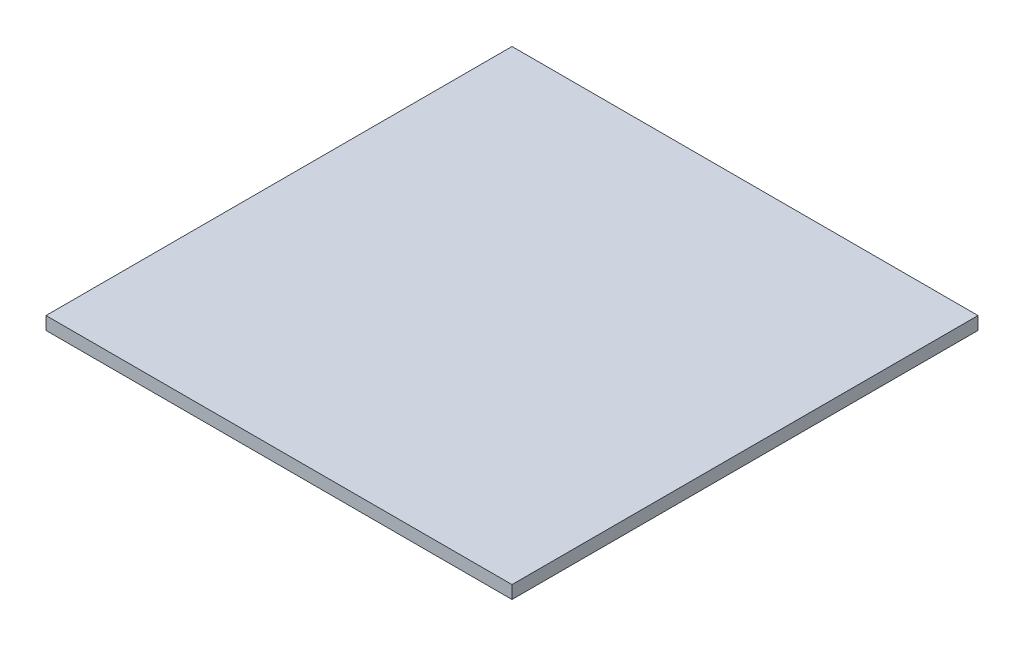
from build123d import *

# Parameters (mm, degrees)
SKETCH2_W           = 1828.8
SKETCH2_H           = 1828.8
BOSS_EXTRUDE1_DEPTH = 50.8


with BuildPart() as part:
    # Sketch2 → Boss-Extrude1 (new body)
    with BuildSketch(Plane(origin=(0, 0, 0), x_dir=(1, 0, 0), z_dir=(0, 1, 0))):
        Rectangle(SKETCH2_W, SKETCH2_H)
    extrude(amount=BOSS_EXTRUDE1_DEPTH)


solid = part.part
